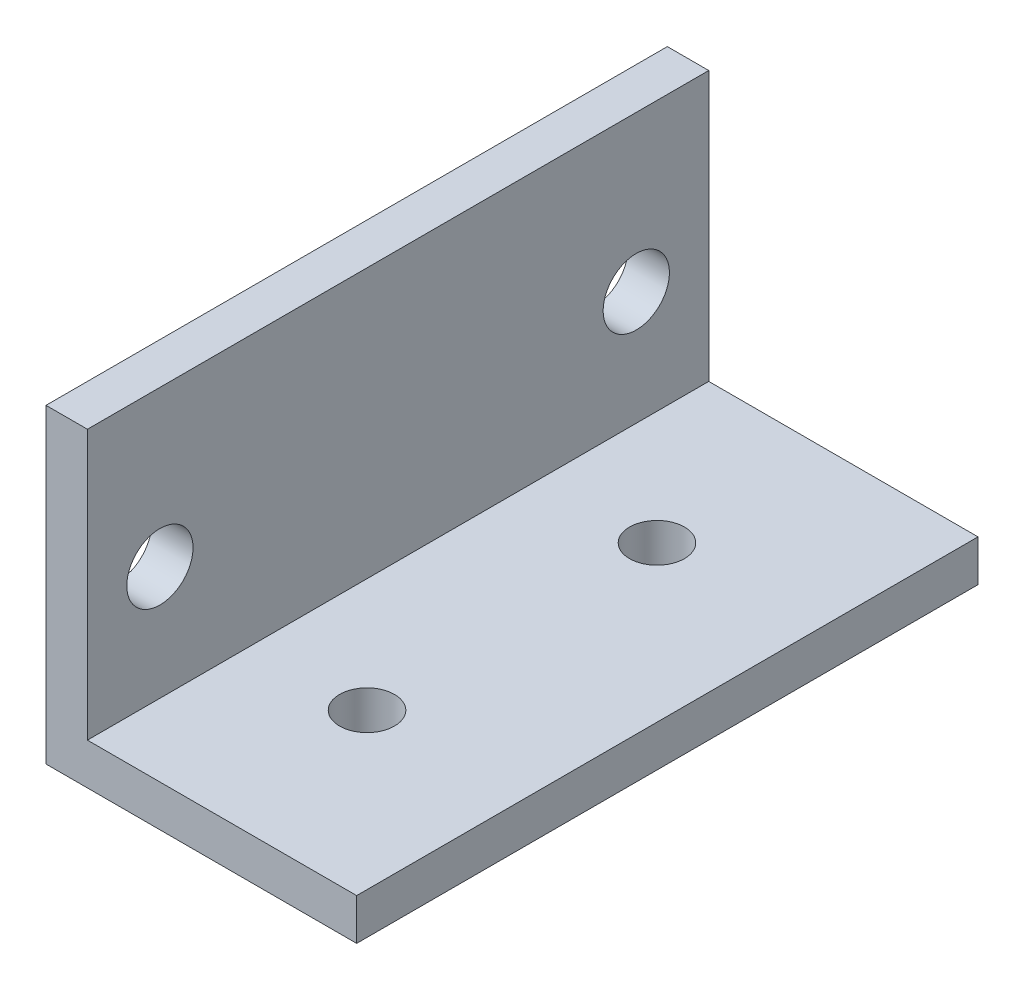
from build123d import *

# Parameters (mm, degrees)
BOSS_EXTRUDE1_DEPTH      = 60
M6_CLEARANCE_HOLE1_D     = 6.4
M6_CLEARANCE_HOLE1_DEPTH = 8
M6_CLEARANCE_HOLE1_TIP   = 1.922753981
M5_CLEARANCE_HOLE1_D     = 5.3
M5_CLEARANCE_HOLE1_DEPTH = 8
M5_CLEARANCE_HOLE1_TIP   = 1.59228064


with BuildPart() as part:
    # Sketch1 → Boss-Extrude1 (new body)
    with BuildSketch(Plane.XY):
        Polygon((0, 30), (0, 0), (30, 0), (30, 4), (4, 4), (4, 30), align=None)
    extrude(amount=BOSS_EXTRUDE1_DEPTH)

    # M6 Clearance Hole1
    with Locations(Plane.ZY):
        with Locations((7, 15), (53, 15)):
            Hole(M6_CLEARANCE_HOLE1_D / 2, depth=M6_CLEARANCE_HOLE1_DEPTH)
            with Locations((0, 0, -(M6_CLEARANCE_HOLE1_DEPTH + M6_CLEARANCE_HOLE1_TIP / 2))):  # 118° drill point
                Cone(0, M6_CLEARANCE_HOLE1_D / 2, M6_CLEARANCE_HOLE1_TIP, mode=Mode.SUBTRACT)

    # M5 Clearance Hole1
    with Locations(Plane(origin=(0, 0, 0), x_dir=(-1, 0, 0), z_dir=(0, -1, 0))):
        with Locations((-15, -16), (-15, -44)):
            Hole(M5_CLEARANCE_HOLE1_D / 2, depth=M5_CLEARANCE_HOLE1_DEPTH)
            with Locations((0, 0, -(M5_CLEARANCE_HOLE1_DEPTH + M5_CLEARANCE_HOLE1_TIP / 2))):  # 118° drill point
                Cone(0, M5_CLEARANCE_HOLE1_D / 2, M5_CLEARANCE_HOLE1_TIP, mode=Mode.SUBTRACT)


solid = part.part
